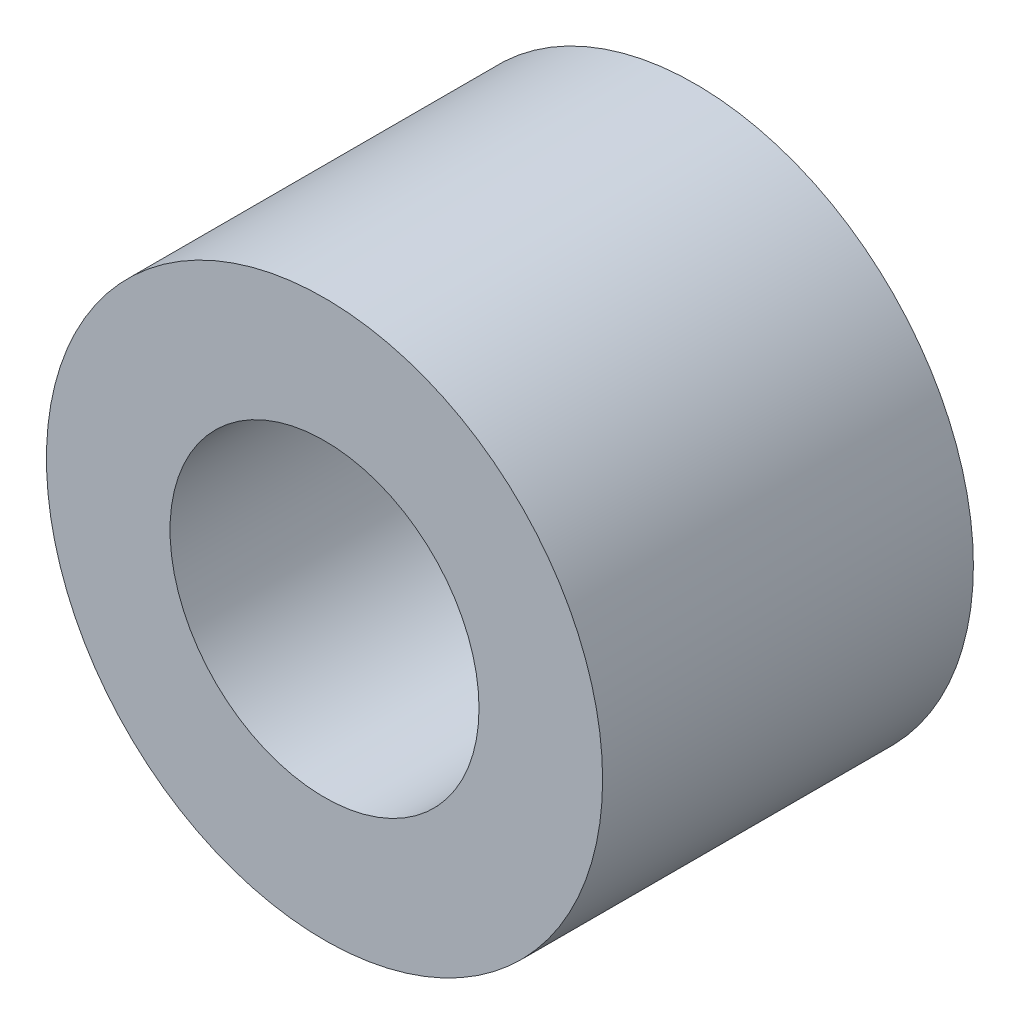
from build123d import *

# Parameters (mm, degrees)
SKETCH1_R           = 4.5
SKETCH1_R_2         = 2.5
BOSS_EXTRUDE1_DEPTH = 6


with BuildPart() as part:
    # Sketch1 → Boss-Extrude1 (new body)
    with BuildSketch(Plane.XY):
        Circle(SKETCH1_R)
        Circle(SKETCH1_R_2, mode=Mode.SUBTRACT)
    extrude(amount=BOSS_EXTRUDE1_DEPTH)


solid = part.part
